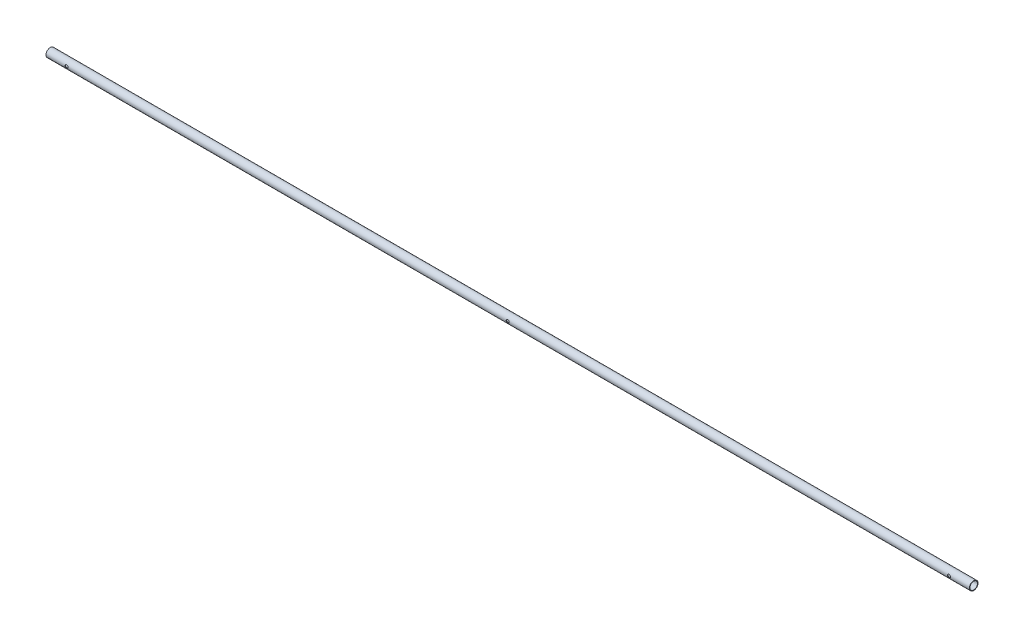
from build123d import *

# Parameters (mm, degrees)
SKETCH1_R               = 8.9662
SKETCH1_R_2             = 7.8994
BOSS_EXTRUDE1_DEPTH     = 1930.4
CUT_EXTRUDE1_DEPTH      = 1931.44164519
CUT_EXTRUDE1_DEPTH_BACK = 1931.44164519
SKETCH2_R               = 3.175


with BuildPart() as part:
    # Sketch1 → Boss-Extrude1 (new body)
    with BuildSketch(Plane(origin=(0, 0, 0), x_dir=(0, 0, -1), z_dir=(1, 0, 0))):
        with Locations(Location((0, 0, 0), (0, 0, 180))):
            Circle(SKETCH1_R)
        with Locations(Location((0, 0, 0), (0, 0, 180))):
            Circle(SKETCH1_R_2, mode=Mode.SUBTRACT)
    extrude(amount=BOSS_EXTRUDE1_DEPTH)

    # Sketch2 → Cut-Extrude1 (cut, two sides: drawn at the far end of the back side and taken through both)
    with BuildSketch(Plane.XY.offset(-CUT_EXTRUDE1_DEPTH_BACK)):
        with Locations((965.2, 0)):
            Circle(SKETCH2_R)
        with Locations((1887.59084, 0)):
            Circle(SKETCH2_R)
        with Locations((42.80916, 0)):
            Circle(SKETCH2_R)
    extrude(amount=CUT_EXTRUDE1_DEPTH + CUT_EXTRUDE1_DEPTH_BACK, mode=Mode.SUBTRACT)


solid = part.part
